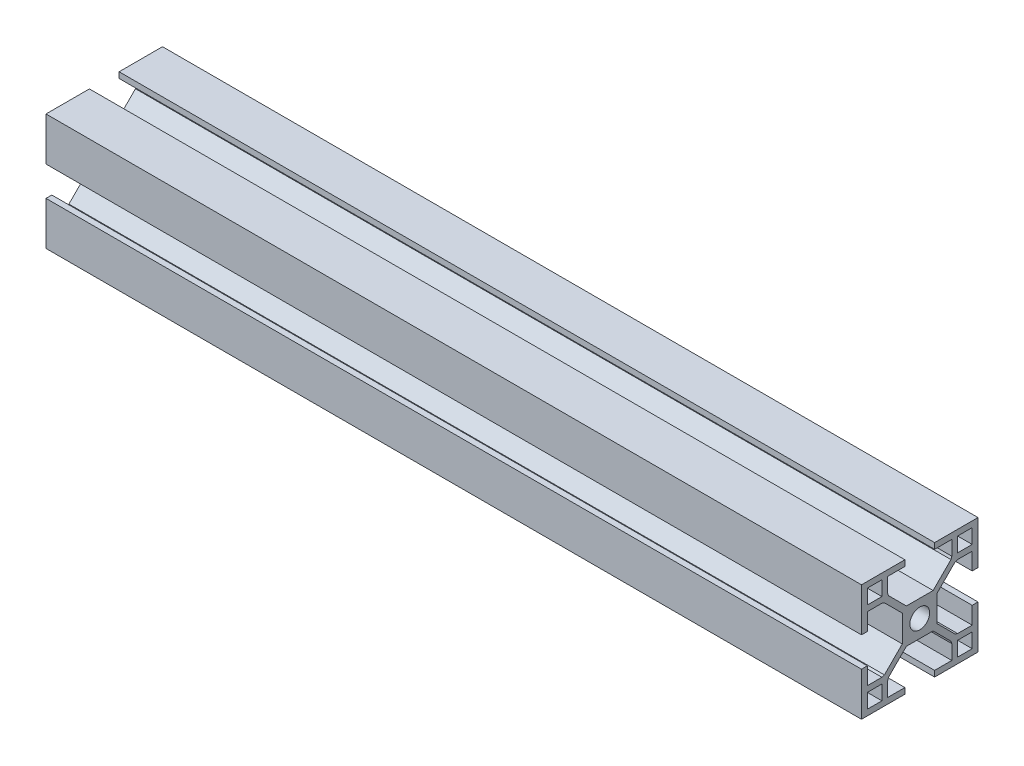
from build123d import *

# Parameters (mm, degrees)
SKETCH_1_R      = 3.4
SKETCH_1_W      = 5
SKETCH_1_H      = 5
EXTRUDE_1_DEPTH = 280


with BuildPart() as part:
    # 草图1 → 凸台-拉伸1 (new body)
    with BuildSketch(Plane(origin=(0, 0, 0), x_dir=(0, 0, -1), z_dir=(1, 0, 0))):
        Polygon((0, 6), (4.585786438, 6), (10.718811909, 12.133025471), (11, 13), (11, 18), (5.1, 18), (5.1, 20), (20, 20), (20, 5.1), (18, 5.1), (18, 11), (13, 11), (12.133025471, 10.718811909), (6, 4.585786438), (6, 0), (6, -4.585786438), (12.133025471, -10.718811909), (13, -11), (18, -11), (18, -5.1), (20, -5.1), (20, -20), (5.1, -20), (5.1, -18), (11, -18), (11, -13), (10.718811909, -12.133025471), (4.585786438, -6), (0, -6), (-4.585786438, -6), (-10.718811909, -12.133025471), (-11, -13), (-11, -18), (-5.1, -18), (-5.1, -20), (-20, -20), (-20, -5.1), (-18, -5.1), (-18, -11), (-13, -11), (-12.133025471, -10.718811909), (-6, -4.585786438), (-6, 0), (-6, 4.585786438), (-12.133025471, 10.718811909), (-13, 11), (-18, 11), (-18, 5.1), (-20, 5.1), (-20, 20), (-5.1, 20), (-5.1, 18), (-11, 18), (-11, 13), (-10.718811909, 12.133025471), (-4.585786438, 6), align=None)
        Circle(SKETCH_1_R, mode=Mode.SUBTRACT)
        with Locations((15.5, -15.5)):
            Rectangle(SKETCH_1_W, SKETCH_1_H, mode=Mode.SUBTRACT)
        with Locations((15.5, 15.5)):
            Rectangle(SKETCH_1_W, SKETCH_1_H, mode=Mode.SUBTRACT)
        with Locations((-15.5, -15.5)):
            Rectangle(SKETCH_1_W, SKETCH_1_H, mode=Mode.SUBTRACT)
        with Locations((-15.5, 15.5)):
            Rectangle(SKETCH_1_W, SKETCH_1_H, mode=Mode.SUBTRACT)
    extrude(amount=EXTRUDE_1_DEPTH)


solid = part.part
